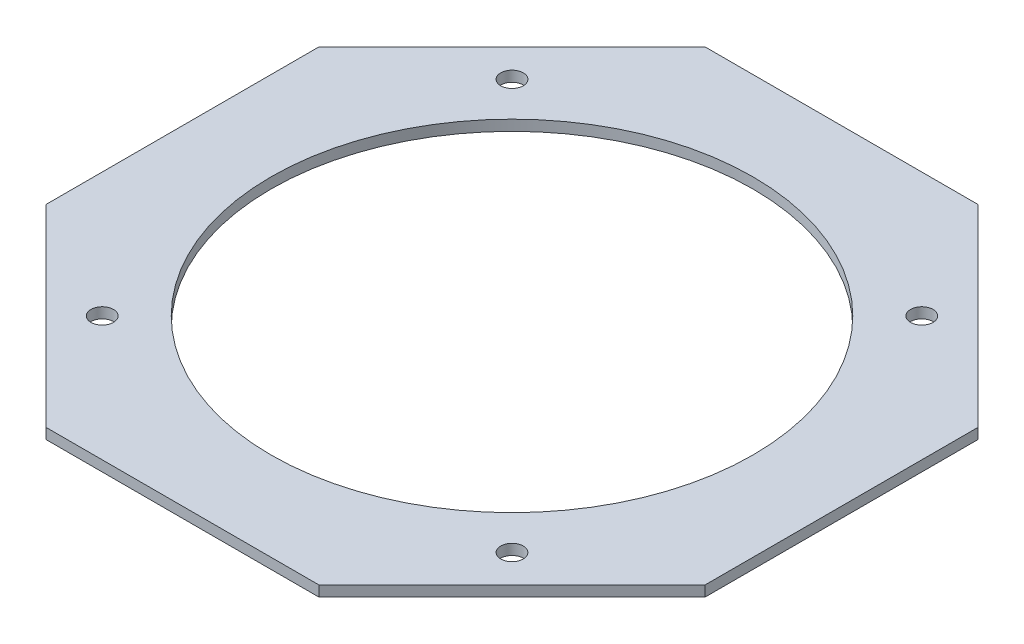
from build123d import *

# Parameters (mm, degrees)
BOSS_EXTRUDE1_DEPTH = 1.83
SKETCH2_R           = 1.95
SKETCH2_R_2         = 41.75
CUT_EXTRUDE1_DEPTH  = 23.83


with BuildPart() as part:
    # Sketch1 → Boss-Extrude1 (new body)
    with BuildSketch(Plane(origin=(0, 0, 0), x_dir=(1, 0, 0), z_dir=(0, 1, 0))):
        Polygon((57.09, -23.647452276), (57.09, 23.647452276), (23.647452276, 57.09), (-23.647452276, 57.09), (-57.09, 23.647452276), (-57.09, -23.647452276), (-23.647452276, -57.09), (23.647452276, -57.09), align=None)
    extrude(amount=BOSS_EXTRUDE1_DEPTH)

    # Sketch2 → Cut-Extrude1 (cut)
    with BuildSketch(Plane(origin=(0, 0, 0), x_dir=(1, 0, 0), z_dir=(0, 1, 0))):
        with Locations(Location((-35.5, 35.5, 0), (0, 0, 90))):
            Circle(SKETCH2_R)
        with Locations(Location((35.5, 35.5, 0), (0, 0, 90))):
            Circle(SKETCH2_R)
        with Locations(Location((35.5, -35.5, 0), (0, 0, 90))):
            Circle(SKETCH2_R)
        with Locations(Location((-35.5, -35.5, 0), (0, 0, 90))):
            Circle(SKETCH2_R)
        with Locations(Location((0, 0, 0), (0, 0, 90))):
            Circle(SKETCH2_R_2)
    extrude(amount=CUT_EXTRUDE1_DEPTH, mode=Mode.SUBTRACT)


solid = part.part
